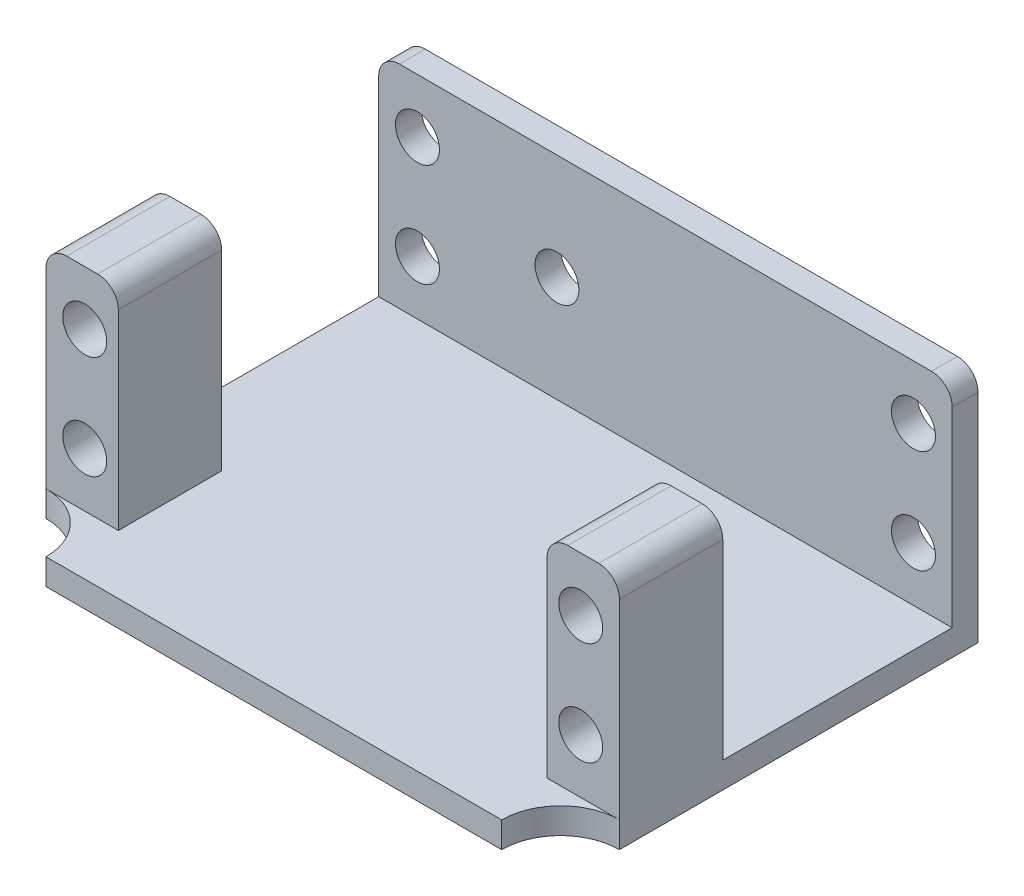
from build123d import *

# Parameters (mm, degrees)
SKETCH1_W                   = 55.5
SKETCH1_H                   = 37.9
BRACKETBASE_DEPTH           = 2.5
SKETCH2_W                   = 7
SKETCH2_H                   = 20.5
SERVOMOUNTINGHOLETABS_DEPTH = 2.5
SKETCH3_R                   = 2.125
SERVOMOUNTINGHOLES_DEPTH    = 2.5
SKETCH4_W                   = 55.5
SKETCH4_H                   = 2.5
BASEWALL_DEPTH              = 23
SKETCH6_R                   = 5.7
BASETRIM_DEPTH              = 2.5
FILLET1_R                   = 2
SKETCH7_R                   = 2.125
M4MOUNTINGHOLE_DEPTH        = 10
SKETCH8_R                   = 2.125
BOSS_EXTRUDE1_DEPTH         = 7.5
SKETCH9_R                   = 2.125
CUT_EXTRUDE1_DEPTH          = 70.378238663


with BuildPart() as part:
    # Sketch1 → bracketBase (new body)
    with BuildSketch(Plane(origin=(0, 0, 0), x_dir=(1, 0, 0), z_dir=(0, 1, 0))):
        with Locations((27.75, 18.95)):
            Rectangle(SKETCH1_W, SKETCH1_H)
    extrude(amount=BRACKETBASE_DEPTH)

    # Sketch2 → servoMountingHoleTabs (add)
    with BuildSketch(Plane.XY.offset(-8.2)):
        with Locations((3.5, 12.75)):
            Rectangle(SKETCH2_W, SKETCH2_H)
        with Locations((52, 12.75)):
            Rectangle(SKETCH2_W, SKETCH2_H)
    extrude(amount=SERVOMOUNTINGHOLETABS_DEPTH)

    # Sketch3 → servoMountingHoles (cut)
    with BuildSketch(Plane.XY.offset(-5.7)):
        with Locations((3.75, 17.75)):
            Circle(SKETCH3_R)
        with Locations(Location((3.75, 7.75, 0), (0, 0, 180))):
            Circle(SKETCH3_R)
        with Locations((51.75, 7.75)):
            Circle(SKETCH3_R)
        with Locations(Location((51.75, 17.75, 0), (0, 0, 180))):
            Circle(SKETCH3_R)
    extrude(amount=-SERVOMOUNTINGHOLES_DEPTH, mode=Mode.SUBTRACT)

    # Sketch4 → baseWall (add)
    with BuildSketch(Plane(origin=(0, 0, 0), x_dir=(1, 0, 0), z_dir=(0, 1, 0))):
        with Locations((27.75, 39.15)):
            Rectangle(SKETCH4_W, SKETCH4_H)
    extrude(amount=BASEWALL_DEPTH)

    # Sketch6 → baseTrim (cut)
    with BuildSketch(Plane(origin=(0, 2.5, 0), x_dir=(1, 0, 0), z_dir=(0, 1, 0))):
        Circle(SKETCH6_R)
        with Locations((55.5, 0)):
            Circle(SKETCH6_R)
    extrude(amount=-BASETRIM_DEPTH, mode=Mode.SUBTRACT)

    # Fillet1
    fillet1_edges = [part.edges().sort_by_distance(p)[0] for p in [
        (0, 23, -6.95),
        (7, 23, -6.95),
        (55.5, 23, -6.95),
        (48.5, 23, -6.95),
        (55.5, 23, -39.15),
        (0, 23, -39.15),
    ]]
    fillet(fillet1_edges, radius=FILLET1_R)

    # Sketch7 → M4mountingHole (cut)
    with BuildSketch(Plane(origin=(0, 0, -40.4), x_dir=(-1, 0, 0), z_dir=(0, 0, -1))):
        with Locations((-17.25, 12.75)):
            Circle(SKETCH7_R)
    extrude(amount=-M4MOUNTINGHOLE_DEPTH, mode=Mode.SUBTRACT)

    # Sketch8 → Boss-Extrude1 (add)
    # profile 1 of 2: a face of its own
    with BuildSketch(Plane(origin=(0, 0, -8.2), x_dir=(-1, 0, 0), z_dir=(0, 0, -1))):
        with BuildLine():
            Line((-48.5, 2.5), (-48.5, 21))
            ThreePointArc((-48.5, 21), (-49.085786438, 22.414213562), (-50.5, 23))
            Line((-50.5, 23), (-53.5, 23))
            ThreePointArc((-53.5, 23), (-54.914213562, 22.414213562), (-55.5, 21))
            Line((-55.5, 21), (-55.5, 2.5))
            Line((-55.5, 2.5), (-48.5, 2.5))
        make_face()
        with Locations((-51.75, 17.75)):
            Circle(SKETCH8_R, mode=Mode.SUBTRACT)
        with Locations(Location((-51.75, 7.75, 0), (0, 0, 180))):
            Circle(SKETCH8_R, mode=Mode.SUBTRACT)
    # profile 2 of 2: a face of its own
    with BuildSketch(Plane(origin=(0, 0, -8.2), x_dir=(-1, 0, 0), z_dir=(0, 0, -1))):
        with BuildLine():
            Line((-2, 23), (-5, 23))
            ThreePointArc((-5, 23), (-6.414213562, 22.414213562), (-7, 21))
            Line((-7, 21), (-7, 2.5))
            Line((-7, 2.5), (0, 2.5))
            Line((0, 2.5), (0, 21))
            ThreePointArc((0, 21), (-0.585786438, 22.414213562), (-2, 23))
        make_face()
        with Locations(Location((-3.75, 17.75, 0), (0, 0, 180))):
            Circle(SKETCH8_R, mode=Mode.SUBTRACT)
        with Locations((-3.75, 7.75)):
            Circle(SKETCH8_R, mode=Mode.SUBTRACT)
    extrude(amount=BOSS_EXTRUDE1_DEPTH)

    # Sketch9 → Cut-Extrude1 (cut, through all)
    with BuildSketch(Plane.XY.offset(-5.7)):
        with Locations((3.75, 17.75)):
            Circle(SKETCH9_R)
        with Locations(Location((3.75, 7.75, 0), (0, 0, 180))):
            Circle(SKETCH9_R)
        with Locations(Location((51.75, 17.75, 0), (0, 0, 180))):
            Circle(SKETCH9_R)
        with Locations((51.75, 7.75)):
            Circle(SKETCH9_R)
    extrude(amount=-CUT_EXTRUDE1_DEPTH, mode=Mode.SUBTRACT)


solid = part.part
